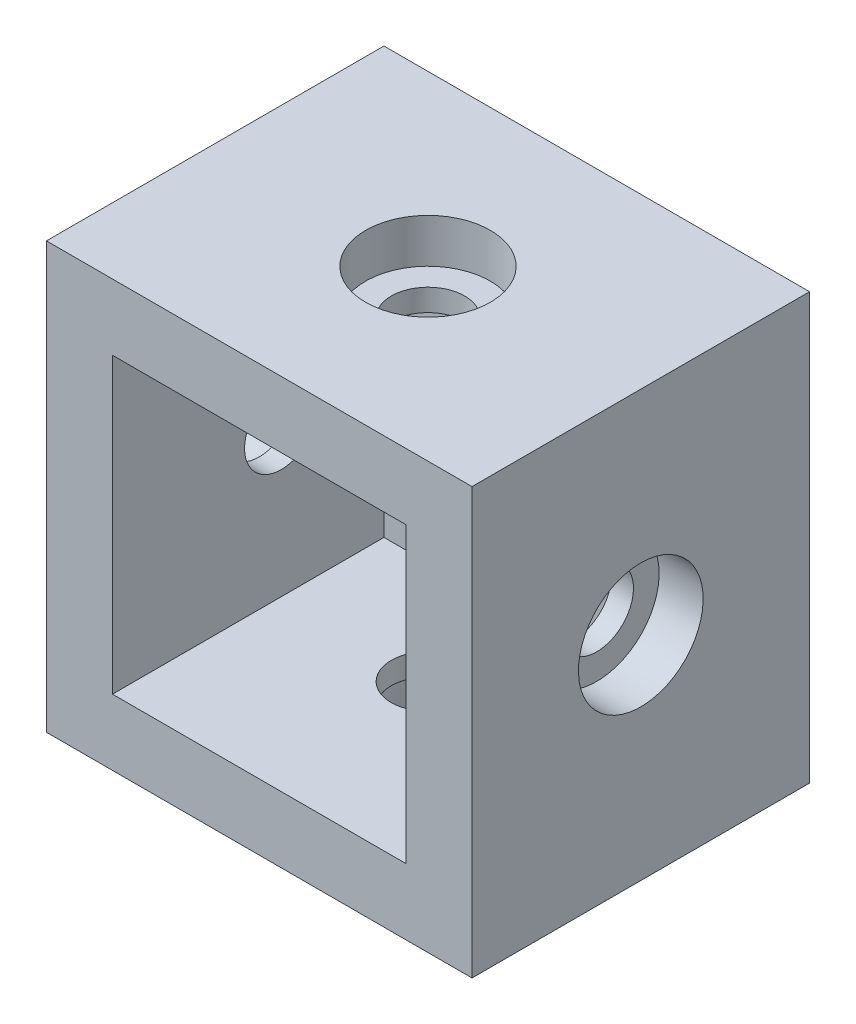
from build123d import *

# Parameters (mm, degrees)
SKETCH2_W           = 29
SKETCH2_H           = 29
BOSS_EXTRUDE3_DEPTH = 23
SHELL3_T            = -4.5
SKETCH7_R           = 4.25
CUT_EXTRUDE9_DEPTH  = 3
SKETCH10_R          = 4.25
CUT_EXTRUDE10_DEPTH = 3
CUT_EXTRUDE11_START = -3
SKETCH9_R           = 4.25
CUT_EXTRUDE11_DEPTH = 3
CUT_EXTRUDE12_START = -3
SKETCH8_R           = 4.25
CUT_EXTRUDE12_DEPTH = 3
SKETCH12_R          = 2.5
CUT_EXTRUDE13_DEPTH = 39.813018756
SKETCH13_R          = 2.5
CUT_EXTRUDE14_DEPTH = 11.5
CUT_EXTRUDE15_START = -11.5
SKETCH14_R          = 2.5
CUT_EXTRUDE15_DEPTH = 11.5


with BuildPart() as part:
    # Sketch2 → Boss-Extrude3 (new body)
    with BuildSketch(Plane.XY):
        with Locations((2.862327752, -2.483638693)):
            Rectangle(SKETCH2_W, SKETCH2_H)
    extrude(amount=BOSS_EXTRUDE3_DEPTH)

    # Shell3
    shell3_openings = [part.faces().sort_by_distance(p)[0] for p in [
        (2.862327752, -2.483638693, 23),
    ]]
    offset(amount=SHELL3_T, openings=shell3_openings, kind=Kind.INTERSECTION)

    # Sketch7 → Cut-Extrude9 (cut)
    with BuildSketch(Plane(origin=(0, -16.983638693, 0), x_dir=(-1, 0, 0), z_dir=(0, -1, 0))):
        with Locations(Location((-2.862327752, -11.5, 0), (0, 0, 90))):
            Circle(SKETCH7_R)
    extrude(amount=-CUT_EXTRUDE9_DEPTH, mode=Mode.SUBTRACT)

    # Sketch10 → Cut-Extrude10 (cut)
    with BuildSketch(Plane(origin=(17.362327752, 0, 0), x_dir=(0, 0, -1), z_dir=(1, 0, 0))):
        with Locations(Location((-11.5, -2.483638693, 0), (0, 0, 90))):
            Circle(SKETCH10_R)
    extrude(amount=-CUT_EXTRUDE10_DEPTH, mode=Mode.SUBTRACT)

    # Sketch9 → Cut-Extrude11 (cut)
    with BuildSketch(Plane(origin=(0, 12.016361307, 0), x_dir=(1, 0, 0), z_dir=(0, 1, 0)).offset(CUT_EXTRUDE11_START)):
        with Locations(Location((2.862327752, -11.5, 0), (0, 0, 90))):
            Circle(SKETCH9_R)
    extrude(amount=CUT_EXTRUDE11_DEPTH, mode=Mode.SUBTRACT)

    # Sketch8 → Cut-Extrude12 (cut)
    with BuildSketch(Plane.ZY.offset(11.637672248).offset(CUT_EXTRUDE12_START)):
        with Locations(Location((11.5, -2.483638693, 0), (0, 0, 90))):
            Circle(SKETCH8_R)
    extrude(amount=CUT_EXTRUDE12_DEPTH, mode=Mode.SUBTRACT)

    # Sketch12 → Cut-Extrude13 (cut, through all)
    with BuildSketch(Plane(origin=(0, 9.016361307, 0), x_dir=(1, 0, 0), z_dir=(0, 1, 0))):
        with Locations(Location((2.862327752, -11.5, 0), (0, 0, 270))):
            Circle(SKETCH12_R)
    extrude(amount=-CUT_EXTRUDE13_DEPTH, mode=Mode.SUBTRACT)

    # Sketch13 → Cut-Extrude14 (cut)
    with BuildSketch(Plane(origin=(14.362327752, 0, 0), x_dir=(0, 0, -1), z_dir=(1, 0, 0))):
        with Locations(Location((-11.5, -2.483638693, 0), (0, 0, 90))):
            Circle(SKETCH13_R)
    extrude(amount=-CUT_EXTRUDE14_DEPTH, mode=Mode.SUBTRACT)

    # Sketch14 → Cut-Extrude15 (cut)
    with BuildSketch(Plane.ZY.offset(8.637672248).offset(CUT_EXTRUDE15_START)):
        with Locations(Location((11.5, -2.483638693, 0), (0, 0, 90))):
            Circle(SKETCH14_R)
    extrude(amount=CUT_EXTRUDE15_DEPTH, mode=Mode.SUBTRACT)


solid = part.part
